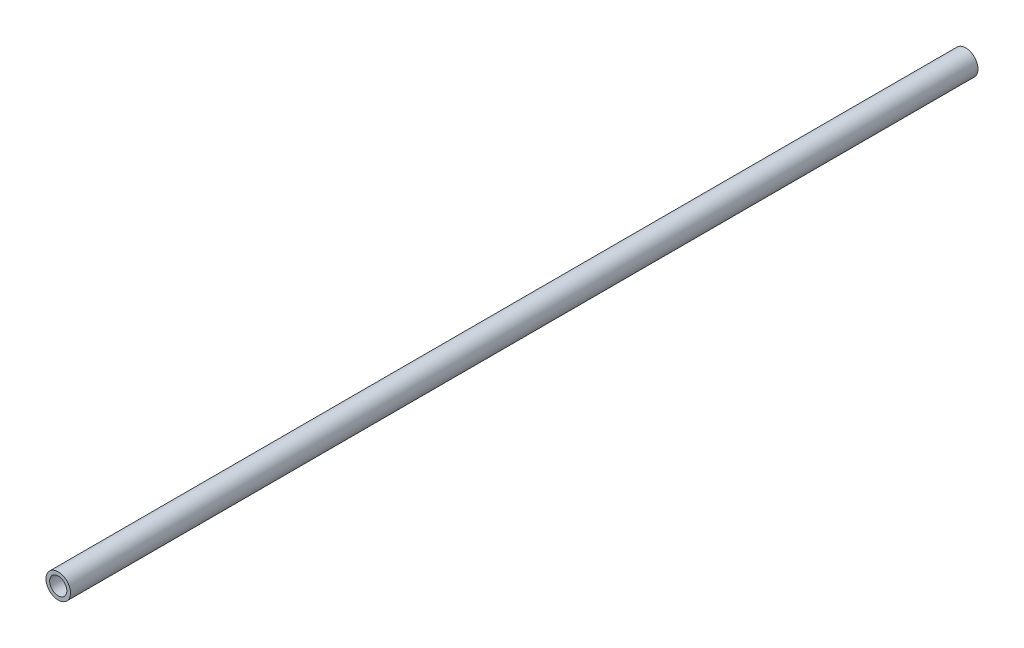
from build123d import *

# Parameters (mm, degrees)
SKETCH1_R           = 5
SKETCH1_R_2         = 3.5
EXTRUDE_THIN1_DEPTH = 185


with BuildPart() as part:
    # Sketch1 → Extrude-Thin1 (new, symmetric)
    with BuildSketch(Plane.XY):
        Circle(SKETCH1_R)
        Circle(SKETCH1_R_2, mode=Mode.SUBTRACT)
    extrude(amount=EXTRUDE_THIN1_DEPTH, both=True)


solid = part.part
